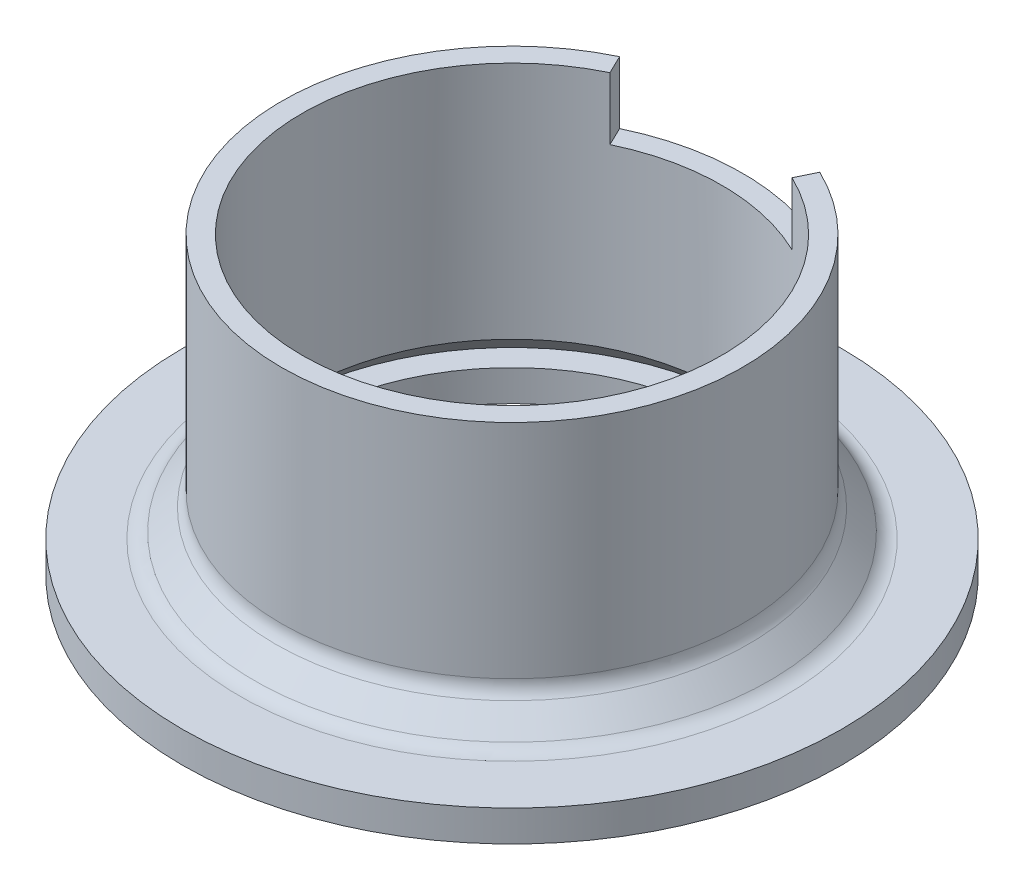
from build123d import *

# Parameters (mm, degrees)
BOSS_EXTRUDE1_START = 3
SKETCH4_R           = 31.75
SKETCH4_R_2         = 20.2
BOSS_EXTRUDE1_DEPTH = 3
FILLET1_R           = 2
FILLET2_R           = 2
BOSS_EXTRUDE2_DEPTH = 1
CIRPATTERN1_COUNT   = 4
CUT_EXTRUDE1_DEPTH  = 6
CUT_EXTRUDE2_DEPTH  = 6


with BuildPart() as part:
    # Sketch3 → Revolve1 (revolve)
    with BuildSketch(Plane.XY, mode=Mode.PRIVATE) as revolve1_sk:
        Polygon((-22.571572875, 0), (-25.4, 0), (-22.2, 3.2), (-22.2, 25.4), (-20.2, 25.4), (-20.2, 2.371572875), align=None)
    revolve(revolve1_sk.sketch.rotate(Axis((0, 25.4, 0), (0, -1, 0)), 270), axis=Axis((0, 25.4, 0), (0, -1, 0)))

    # Sketch4 → Boss-Extrude1 (add)
    with BuildSketch(Plane.XZ.offset(BOSS_EXTRUDE1_START)):
        with Locations(Location((0, 0, 0), (0, 0, 270))):
            Circle(SKETCH4_R)
        with Locations(Location((0, 0, 0), (0, 0, 90))):
            Circle(SKETCH4_R_2, mode=Mode.SUBTRACT)
    extrude(amount=-BOSS_EXTRUDE1_DEPTH)

    # Fillet1
    fillet1_edges = [part.edges().sort_by_distance(p)[0] for p in [
        (0, 0, -25.4),
    ]]
    fillet(fillet1_edges, radius=FILLET1_R)

    # Fillet2
    fillet2_edges = [part.edges().sort_by_distance(p)[0] for p in [
        (0, 3.2, -22.2),
    ]]
    fillet(fillet2_edges, radius=FILLET2_R)

    # Sketch5 → Boss-Extrude2 (add, symmetric)
    with BuildSketch(Plane.XY):
        Polygon((20.2, 0), (23.444013634, 0), (23.444013634, 1.439043573), (20.2, 4.645223745), align=None)
    boss_extrude2 = extrude(amount=BOSS_EXTRUDE2_DEPTH, both=True)

    # CirPattern1: Boss-Extrude2 ×4 about axis
    cirpattern1_axis = Axis((0, 0, 0), (0, 1, 0))
    for i in range(1, CIRPATTERN1_COUNT):
        add(boss_extrude2.rotate(cirpattern1_axis, i * 360 / CIRPATTERN1_COUNT))

    # Sketch6 → Cut-Extrude1 (cut)
    with BuildSketch(Plane(origin=(0, 25.4, 0), x_dir=(1, 0, 0), z_dir=(0, 1, 0))):
        with BuildLine():
            Line((0, 20), (-13.834891336, 20))
            ThreePointArc((-13.834891336, 20), (0, 24.318803801), (13.834891336, 20))
            Line((13.834891336, 20), (0, 20))
        make_face()
    extrude(amount=-CUT_EXTRUDE1_DEPTH, mode=Mode.SUBTRACT)

    # Sketch7 → Cut-Extrude2 (cut)
    with BuildSketch(Plane(origin=(0, 25.4, 0), x_dir=(1, 0, 0), z_dir=(0, 1, 0))):
        Polygon((-9.635351576, 20), (2.835489376, 20), (9.635351576, 20), (7.753188698, 16.093213904), (-7.753188698, 16.093213904), align=None)
    extrude(amount=-CUT_EXTRUDE2_DEPTH, mode=Mode.SUBTRACT)


solid = part.part
